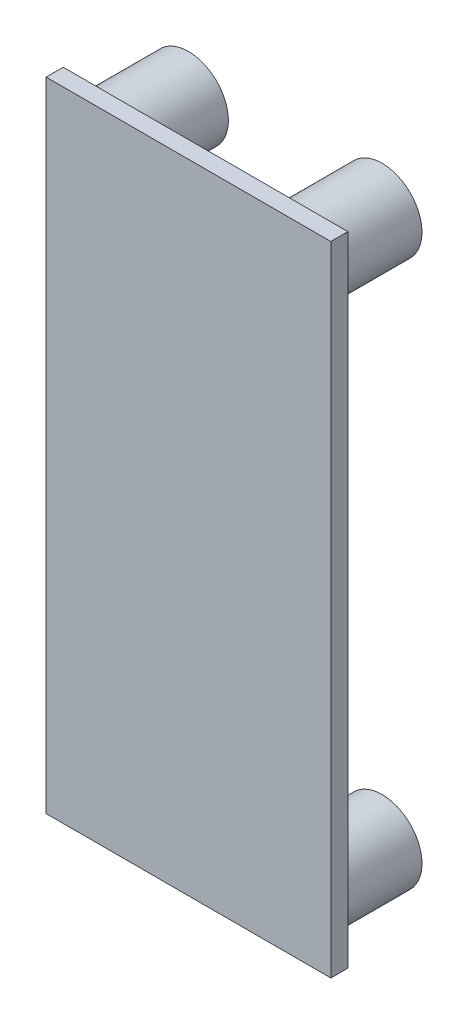
from build123d import *

# Parameters (mm, degrees)
SKETCH_1_W      = 25
SKETCH_1_H      = 56
EXTRUDE_1_DEPTH = 1.5
SKETCH_2_R      = 3.5
SKETCH_2_R_2    = 1.5
EXTRUDE_2_DEPTH = 7


with BuildPart() as part:
    # Эскиз1 → Бобышка-Вытянуть1 (new body)
    with BuildSketch(Plane.XY):
        with Locations((12.5, 28)):
            Rectangle(SKETCH_1_W, SKETCH_1_H)
    extrude(amount=EXTRUDE_1_DEPTH)

    # Эскиз2 → Бобышка-Вытянуть2 (add)
    # profile 1 of 4: a face of its own
    with BuildSketch(Plane(origin=(0, 0, 0), x_dir=(-1, 0, 0), z_dir=(0, 0, -1))):
        with Locations((-21, 52.2)):
            Circle(SKETCH_2_R)
        with Locations((-21, 52.2)):
            Circle(SKETCH_2_R_2, mode=Mode.SUBTRACT)
    # profile 2 of 4: a face of its own
    with BuildSketch(Plane(origin=(0, 0, 0), x_dir=(-1, 0, 0), z_dir=(0, 0, -1))):
        with Locations((-4, 52.2)):
            Circle(SKETCH_2_R)
        with Locations((-4, 52.2)):
            Circle(SKETCH_2_R_2, mode=Mode.SUBTRACT)
    # profile 3 of 4: a face of its own
    with BuildSketch(Plane(origin=(0, 0, 0), x_dir=(-1, 0, 0), z_dir=(0, 0, -1))):
        with Locations((-21, 4.2)):
            Circle(SKETCH_2_R)
        with Locations((-21, 4.2)):
            Circle(SKETCH_2_R_2, mode=Mode.SUBTRACT)
    # profile 4 of 4: a face of its own
    with BuildSketch(Plane(origin=(0, 0, 0), x_dir=(-1, 0, 0), z_dir=(0, 0, -1))):
        with Locations((-4, 4.2)):
            Circle(SKETCH_2_R)
        with Locations((-4, 4.2)):
            Circle(SKETCH_2_R_2, mode=Mode.SUBTRACT)
    extrude(amount=EXTRUDE_2_DEPTH)


solid = part.part
